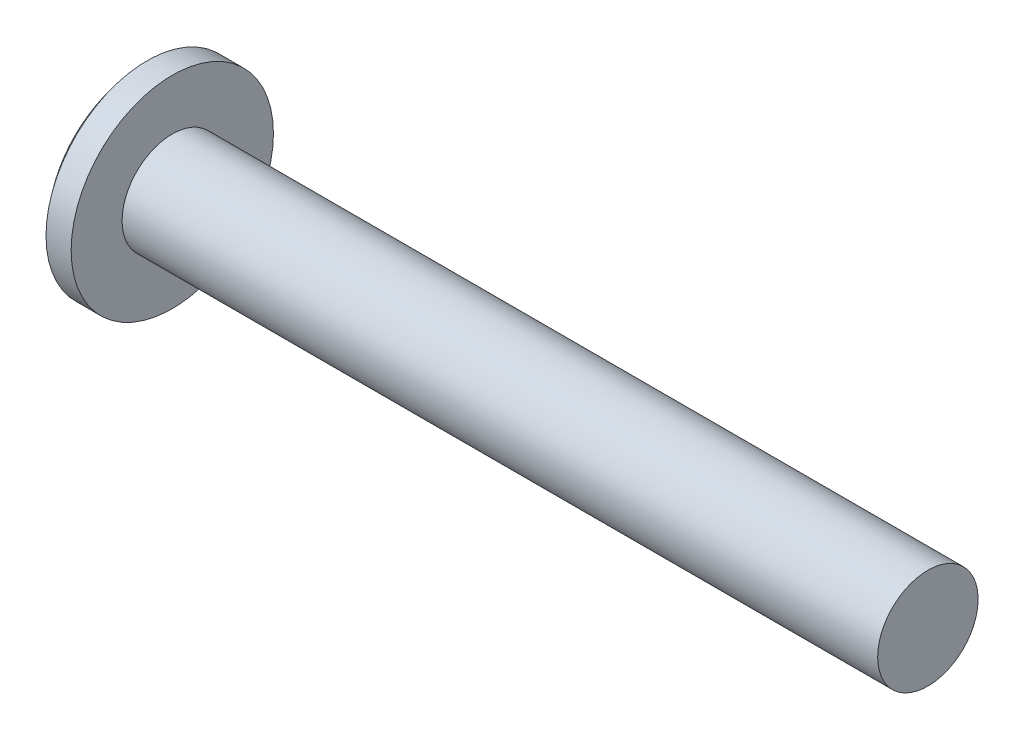
from build123d import *

# Parameters (mm, degrees)
CIRPATTERN1_COUNT = 2
CIRPATTERN1_ANGLE = 90


with BuildPart() as part:
    # BodySke → Base-Revolve (revolve)
    with BuildSketch(Plane.XY, mode=Mode.PRIVATE) as base_revolve_sk:
        with BuildLine():
            Line((3.4036, 2.7432), (3.4036, 5.525))
            Line((3.4036, 5.525), (2.029758706, 5.525))
            ThreePointArc((2.029758706, 5.525), (0.523495119, 2.943023335), (0, 0))
            Line((0, 0), (44.6786, 0))
            Line((44.6786, 0), (44.6786, 2.7432))
            Line((44.6786, 2.7432), (3.4036, 2.7432))
        make_face()
    revolve(base_revolve_sk.sketch.rotate(Axis((-25.4, 0, 0), (1, 0, 0)), 90), axis=Axis((-25.4, 0, 0), (1, 0, 0)))

    # Sketch3 → Cross section 0
    with BuildSketch(Plane(origin=(0, 0, 0), x_dir=(0, 0, -1), z_dir=(1, 0, 0))):
        with BuildLine():
            Line((0.6477, -3.6322), (-0.6477, -3.6322))
            Line((-0.6477, -3.6322), (-0.6477, 3.6322))
            Line((-0.6477, 3.6322), (0.6477, 3.6322))
            Line((0.6477, 3.6322), (0.6477, -3.6322))
        make_face()
    # Sketch4 → Cross section 1
    with BuildSketch(Plane(origin=(4.2418, 0, 0), x_dir=(0, 0, -1), z_dir=(1, 0, 0))):
        with BuildLine():
            Line((0.32385, -0.32385), (-0.32385, -0.32385))
            Line((-0.32385, -0.32385), (-0.32385, 0.32385))
            Line((-0.32385, 0.32385), (0.32385, 0.32385))
            Line((0.32385, 0.32385), (0.32385, -0.32385))
        make_face()
    cross = loft(mode=Mode.SUBTRACT)

    # CirPattern1: Cross ×2 about axis
    cirpattern1_axis = Axis((0, 0, 0), (1, 0, 0))
    for i in range(1, CIRPATTERN1_COUNT):
        add(cross.rotate(cirpattern1_axis, i * CIRPATTERN1_ANGLE / (CIRPATTERN1_COUNT - 1)), mode=Mode.SUBTRACT)


solid = part.part
